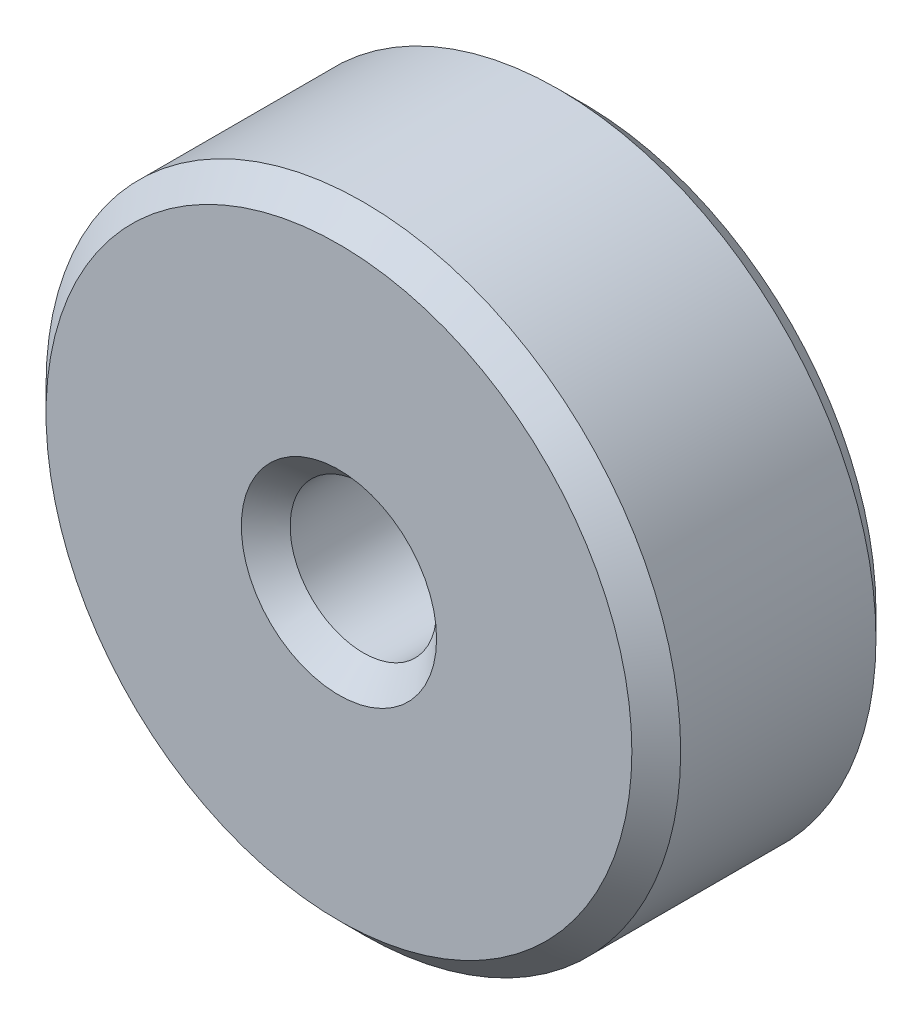
from build123d import *

# Parameters (mm, degrees)
ESQUISSE1_R        = 6.5
ESQUISSE1_R_2      = 1.5
BOSS_EXTRU_1_DEPTH = 5
CHANFREIN1_SIZE    = 0.5


with BuildPart() as part:
    # Esquisse1 → Boss.-Extru.1 (new body)
    with BuildSketch(Plane.XY):
        Circle(ESQUISSE1_R)
        Circle(ESQUISSE1_R_2, mode=Mode.SUBTRACT)
    extrude(amount=BOSS_EXTRU_1_DEPTH)

    # Chanfrein1
    chanfrein1_edges = [part.edges().sort_by_distance(p)[0] for p in [
        (-6.5, 0, 0),
        (-6.5, 0, 5),
        (-1.5, 0, 0),
        (-1.5, 0, 5),
    ]]
    chamfer(chanfrein1_edges, length=CHANFREIN1_SIZE)


solid = part.part
